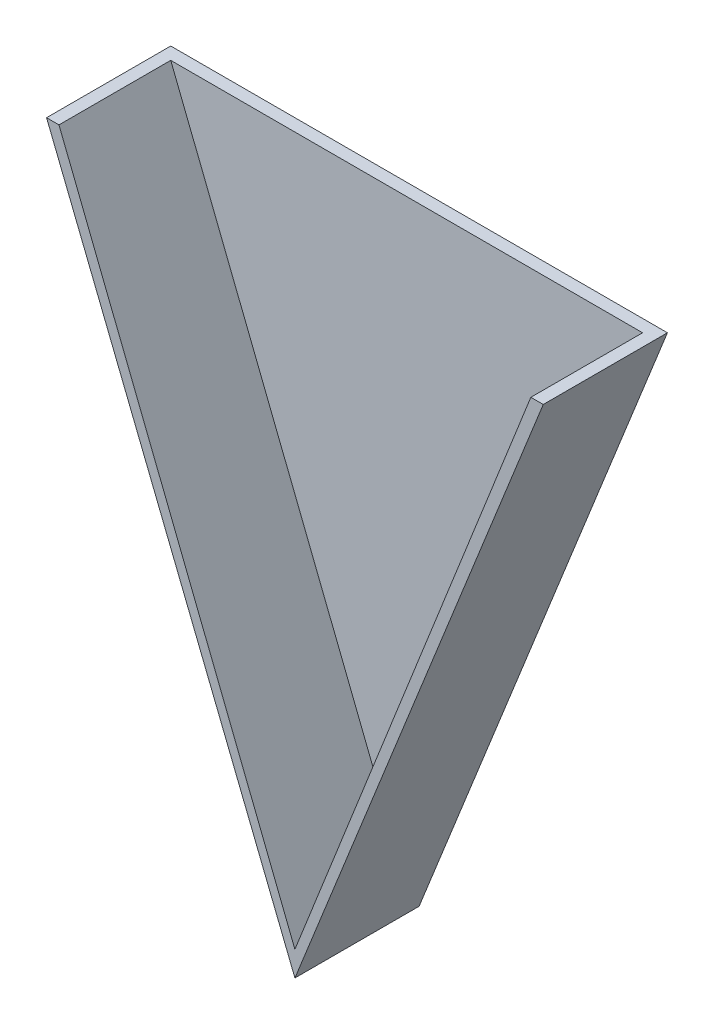
from build123d import *

# Parameters (mm, degrees)
BOSS_EXTRUDE1_DEPTH = 0.254
CUT_EXTRUDE1_DEPTH  = 0.2794


with BuildPart() as part:
    # Sketch1 → Boss-Extrude1 (new body)
    with BuildSketch(Plane.XY):
        Polygon((-0.508, 0), (0, -1.27), (0.508, 0), align=None)
    extrude(amount=-BOSS_EXTRUDE1_DEPTH)

    # Sketch2 → Cut-Extrude1 (cut)
    with BuildSketch(Plane.XY.offset(-0.2286)):
        Polygon((-0.4826, 0), (0, -1.2192), (0.4826, 0), align=None)
    extrude(amount=CUT_EXTRUDE1_DEPTH, mode=Mode.SUBTRACT)


solid = part.part
